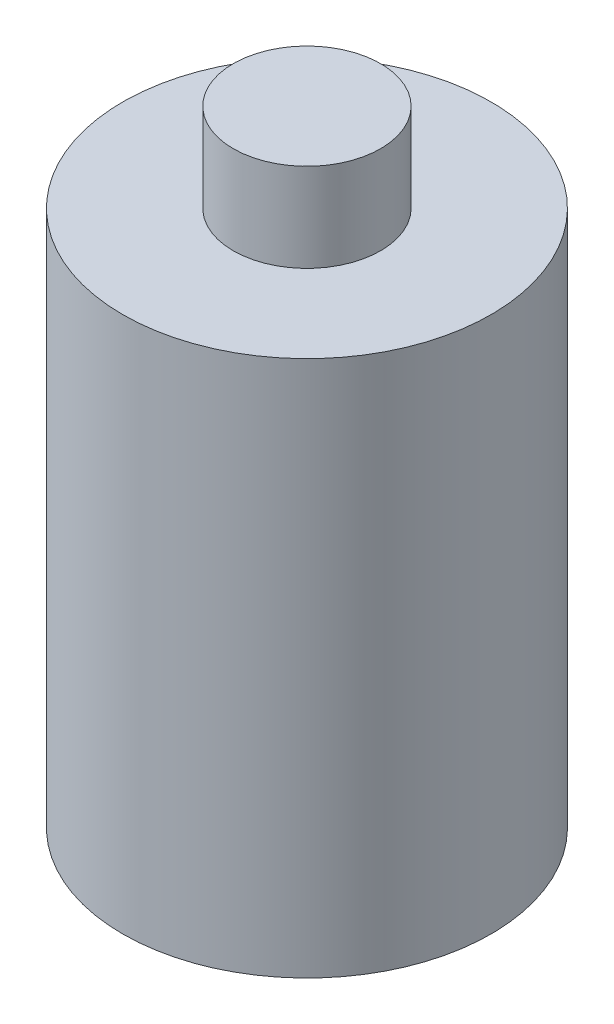
from build123d import *

# Parameters (mm, degrees)
SKETCH_1_R      = 6.25
EXTRUDE_1_DEPTH = 18.2
SKETCH_2_R      = 2.5
EXTRUDE_2_DEPTH = 3


with BuildPart() as part:
    # 草图1 → 凸台-拉伸1 (new body)
    with BuildSketch(Plane(origin=(0, 0, 0), x_dir=(1, 0, 0), z_dir=(0, 1, 0))):
        with Locations(Location((0, 0, 0), (0, 0, 270))):
            Circle(SKETCH_1_R)
    extrude(amount=EXTRUDE_1_DEPTH)

    # 草图2 → 凸台-拉伸2 (add)
    with BuildSketch(Plane(origin=(0, 18.2, 0), x_dir=(1, 0, 0), z_dir=(0, 1, 0))):
        with Locations(Location((0, 0, 0), (0, 0, 270))):
            Circle(SKETCH_2_R)
    extrude(amount=EXTRUDE_2_DEPTH)


solid = part.part
